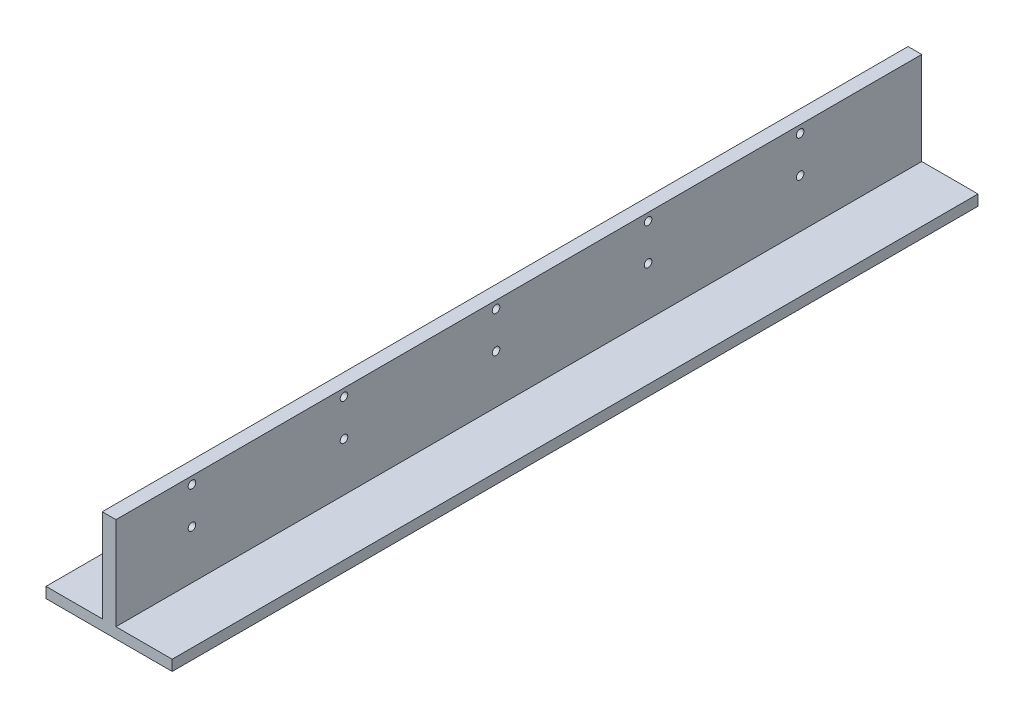
from build123d import *

# Parameters (mm, degrees)
BOSS_EXTRU_1_DEPTH      = 530
ESQUISSE2_R             = 2.5
ENL_V_MAT_EXTRU_1_DEPTH = 9


with BuildPart() as part:
    # Esquisse1 → Boss.-Extru.1 (new body)
    with BuildSketch(Plane.XY):
        Polygon((0, 0), (83, 0), (83, 7), (46, 7), (46, 68), (37, 68), (37, 7), (0, 7), align=None)
    extrude(amount=BOSS_EXTRU_1_DEPTH)

    # Esquisse2 → Enlèv. mat.-Extru.1 (cut)
    with BuildSketch(Plane.ZY.offset(-37)):
        with Locations(Location((80, 63, 0), (0, 0, 270))):
            Circle(ESQUISSE2_R)
        with Locations(Location((80, 39, 0), (0, 0, 90))):
            Circle(ESQUISSE2_R)
        with Locations(Location((180, 63, 0), (0, 0, 270))):
            Circle(ESQUISSE2_R)
        with Locations(Location((180, 39, 0), (0, 0, 90))):
            Circle(ESQUISSE2_R)
        with Locations(Location((280, 63, 0), (0, 0, 270))):
            Circle(ESQUISSE2_R)
        with Locations(Location((280, 39, 0), (0, 0, 90))):
            Circle(ESQUISSE2_R)
        with Locations(Location((380, 63, 0), (0, 0, 270))):
            Circle(ESQUISSE2_R)
        with Locations(Location((380, 39, 0), (0, 0, 90))):
            Circle(ESQUISSE2_R)
        with Locations(Location((480, 63, 0), (0, 0, 270))):
            Circle(ESQUISSE2_R)
        with Locations(Location((480, 39, 0), (0, 0, 90))):
            Circle(ESQUISSE2_R)
    extrude(amount=-ENL_V_MAT_EXTRU_1_DEPTH, mode=Mode.SUBTRACT)


solid = part.part
